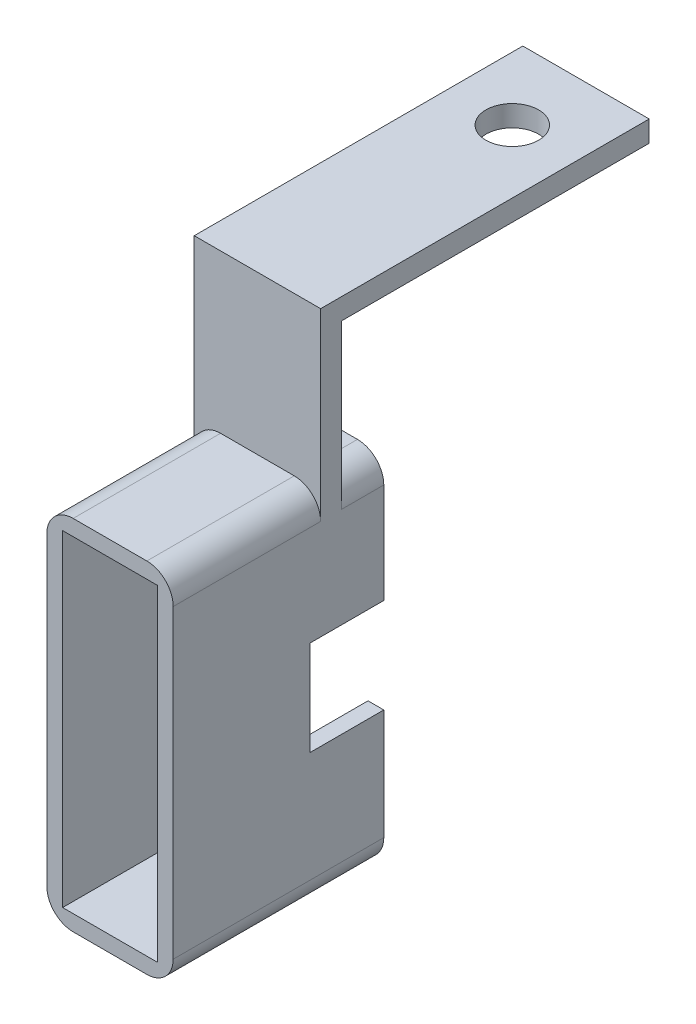
from build123d import *

# Parameters (mm, degrees)
ESQUISSE1_W                  = 9
ESQUISSE1_H                  = 31
BOSS_EXTRU_1_DEPTH           = 20
ESQUISSE3_W                  = 12
ESQUISSE3_H                  = 2
BOSS_EXTRU_2_DEPTH           = 15
ESQUISSE4_W                  = 12
ESQUISSE4_H                  = 2
BOSS_EXTRU_3_DEPTH           = 29.2
ESQUISSE5_R                  = 2.5
ENL_V_MAT_EXTRU_3_DEPTH      = 10
CONG_1_R                     = 2.5
CONG_2_R                     = 2.5
ENL_V_MAT_EXTRU_5_DEPTH      = 43.629642176
ENL_V_MAT_EXTRU_5_DEPTH_BACK = 5
ESQUISSE6_W                  = 7
ESQUISSE6_H                  = 11
ENL_V_MAT_EXTRU_2_DEPTH      = 43.629642176
ENL_V_MAT_EXTRU_2_DEPTH_BACK = 5
ESQUISSE2_W                  = 7
ESQUISSE2_H                  = 9


with BuildPart() as part:
    # Esquisse1 → Boss.-Extru.1 (new body)
    with BuildSketch(Plane.XY):
        Polygon((-22.275714661, 15.721830986), (-22.275714661, -12.778169014), (-22.275714661, -16.778169014), (-10.275714661, -16.778169014), (-10.275714661, 17.221830986), (-22.275714661, 17.221830986), align=None)
        with Locations((-16.275714661, 0.221830986)):
            Rectangle(ESQUISSE1_W, ESQUISSE1_H, mode=Mode.SUBTRACT)
    extrude(amount=BOSS_EXTRU_1_DEPTH)

    # Esquisse3 → Boss.-Extru.2 (add)
    with BuildSketch(Plane(origin=(0, 17.221830986, 0), x_dir=(1, 0, 0), z_dir=(0, 1, 0))):
        with Locations((-16.275714661, -5)):
            Rectangle(ESQUISSE3_W, ESQUISSE3_H)
    extrude(amount=BOSS_EXTRU_2_DEPTH)

    # Esquisse4 → Boss.-Extru.3 (add)
    with BuildSketch(Plane(origin=(0, 0, 4), x_dir=(-1, 0, 0), z_dir=(0, 0, -1))):
        with Locations((16.275714661, 31.221830986)):
            Rectangle(ESQUISSE4_W, ESQUISSE4_H)
    extrude(amount=BOSS_EXTRU_3_DEPTH)

    # Esquisse5 → Enlèv. mat.-Extru.3 (cut)
    with BuildSketch(Plane(origin=(0, 32.221830986, 0), x_dir=(1, 0, 0), z_dir=(0, 1, 0))):
        with Locations(Location((-16.275714661, 18.2, 0), (0, 0, 270))):
            Circle(ESQUISSE5_R)
    extrude(amount=-ENL_V_MAT_EXTRU_3_DEPTH, mode=Mode.SUBTRACT)

    # Congé1
    cong_1_edges = [part.edges().sort_by_distance(p)[0] for p in [
        (-10.275714661, 17.221830986, 13),
        (-10.275714661, -16.778169014, 10),
    ]]
    fillet(cong_1_edges, radius=CONG_1_R)

    # Congé2
    cong_2_edges = [part.edges().sort_by_distance(p)[0] for p in [
        (-22.275714661, 17.221830986, 13),
        (-22.275714661, -16.778169014, 10),
        (-22.275714661, 17.221830986, 2),
        (-10.275714661, 17.221830986, 2),
    ]]
    fillet(cong_2_edges, radius=CONG_2_R)

    # Esquisse6 → Enlèv. mat.-Extru.5 (cut, two sides: drawn at the far end of the back side and taken through both)
    with BuildSketch(Plane.ZY.offset(22.275714661).offset(-ENL_V_MAT_EXTRU_5_DEPTH_BACK)):
        with Locations((3.5, 1.721830986)):
            Rectangle(ESQUISSE6_W, ESQUISSE6_H)
    extrude(amount=ENL_V_MAT_EXTRU_5_DEPTH + ENL_V_MAT_EXTRU_5_DEPTH_BACK, mode=Mode.SUBTRACT)

    # Esquisse2 → Enlèv. mat.-Extru.2 (cut, two sides: drawn at the far end of the back side and taken through both)
    with BuildSketch(Plane(origin=(-10.275714661, 0, 0), x_dir=(0, 0, -1), z_dir=(1, 0, 0)).offset(-ENL_V_MAT_EXTRU_2_DEPTH_BACK)):
        with Locations((-3.5, 0.721830986)):
            Rectangle(ESQUISSE2_W, ESQUISSE2_H)
    extrude(amount=ENL_V_MAT_EXTRU_2_DEPTH + ENL_V_MAT_EXTRU_2_DEPTH_BACK, mode=Mode.SUBTRACT)


solid = part.part
